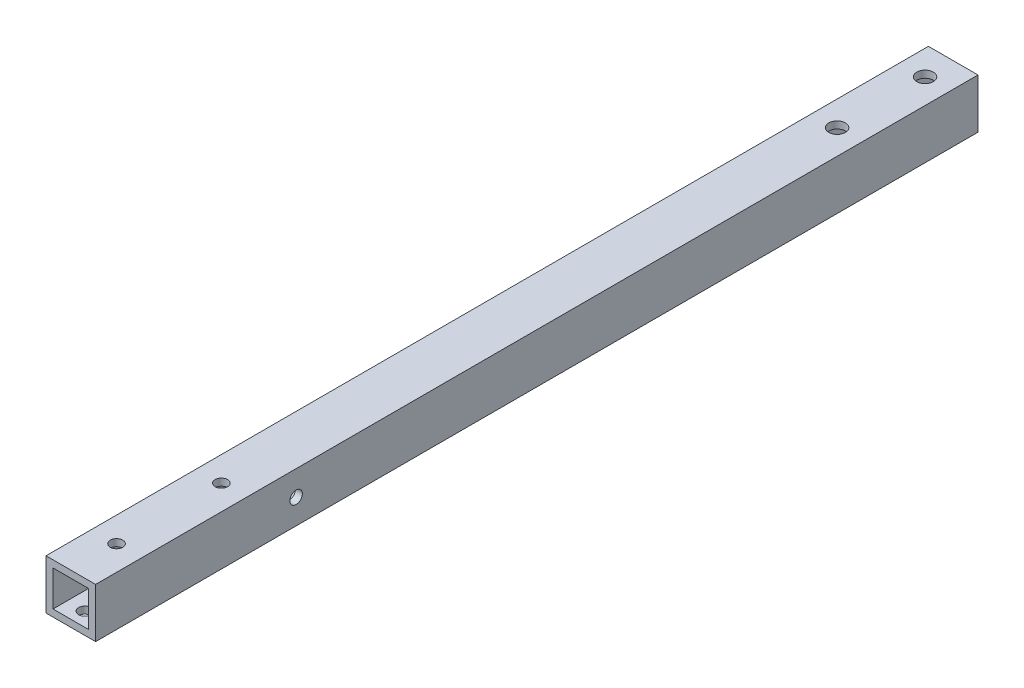
from build123d import *

# Parameters (mm, degrees)
SKETCH1_W           = 14.1
SKETCH1_H           = 14.1
BOSS_EXTRUDE1_DEPTH = 250.825
SKETCH2_W           = 10.1
SKETCH2_H           = 10.1
CUT_EXTRUDE1_DEPTH  = 255.432185656
SKETCH3_R           = 1.775
SKETCH3_R_2         = 2.358740524
CUT_EXTRUDE2_DEPTH  = 254.524349476
SKETCH4_R           = 1.775
CUT_EXTRUDE3_DEPTH  = 2
SKETCH5_R           = 1.775
CUT_EXTRUDE4_DEPTH  = 253.531071247


with BuildPart() as part:
    # Sketch1 → Boss-Extrude1 (new body)
    with BuildSketch(Plane.XY):
        with Locations((27.046996237, 18.639517713)):
            Rectangle(SKETCH1_W, SKETCH1_H)
    extrude(amount=BOSS_EXTRUDE1_DEPTH)

    # Sketch2 → Cut-Extrude1 (cut, through all)
    with BuildSketch(Plane.XY.offset(250.825)):
        with Locations((27.046996237, 18.639517713)):
            Rectangle(SKETCH2_W, SKETCH2_H)
    extrude(amount=-CUT_EXTRUDE1_DEPTH, mode=Mode.SUBTRACT)

    # Sketch3 → Cut-Extrude2 (cut, through all)
    with BuildSketch(Plane.XZ.offset(-11.589517713)):
        with Locations(Location((27.046996237, 237.825, 0), (0, 0, 270))):
            Circle(SKETCH3_R)
        with Locations(Location((27.046996237, 208.025, 0), (0, 0, 270))):
            Circle(SKETCH3_R)
        with Locations(Location((27.046996237, 8, 0), (0, 0, 270))):
            Circle(SKETCH3_R_2)
        with Locations(Location((27.046996237, 33, 0), (0, 0, 270))):
            Circle(SKETCH3_R_2)
    extrude(amount=-CUT_EXTRUDE2_DEPTH, mode=Mode.SUBTRACT)

    # Sketch4 → Cut-Extrude3 (cut)
    with BuildSketch(Plane.XZ.offset(-11.589517713)):
        with Locations(Location((27.046996237, 246.825, 0), (0, 0, 270))):
            Circle(SKETCH4_R)
    extrude(amount=-CUT_EXTRUDE3_DEPTH, mode=Mode.SUBTRACT)

    # Sketch5 → Cut-Extrude4 (cut, through all)
    with BuildSketch(Plane(origin=(34.096996237, 0, 0), x_dir=(0, 0, -1), z_dir=(1, 0, 0))):
        with Locations((-193.825, 18.639517713)):
            Circle(SKETCH5_R)
    extrude(amount=-CUT_EXTRUDE4_DEPTH, mode=Mode.SUBTRACT)


solid = part.part
